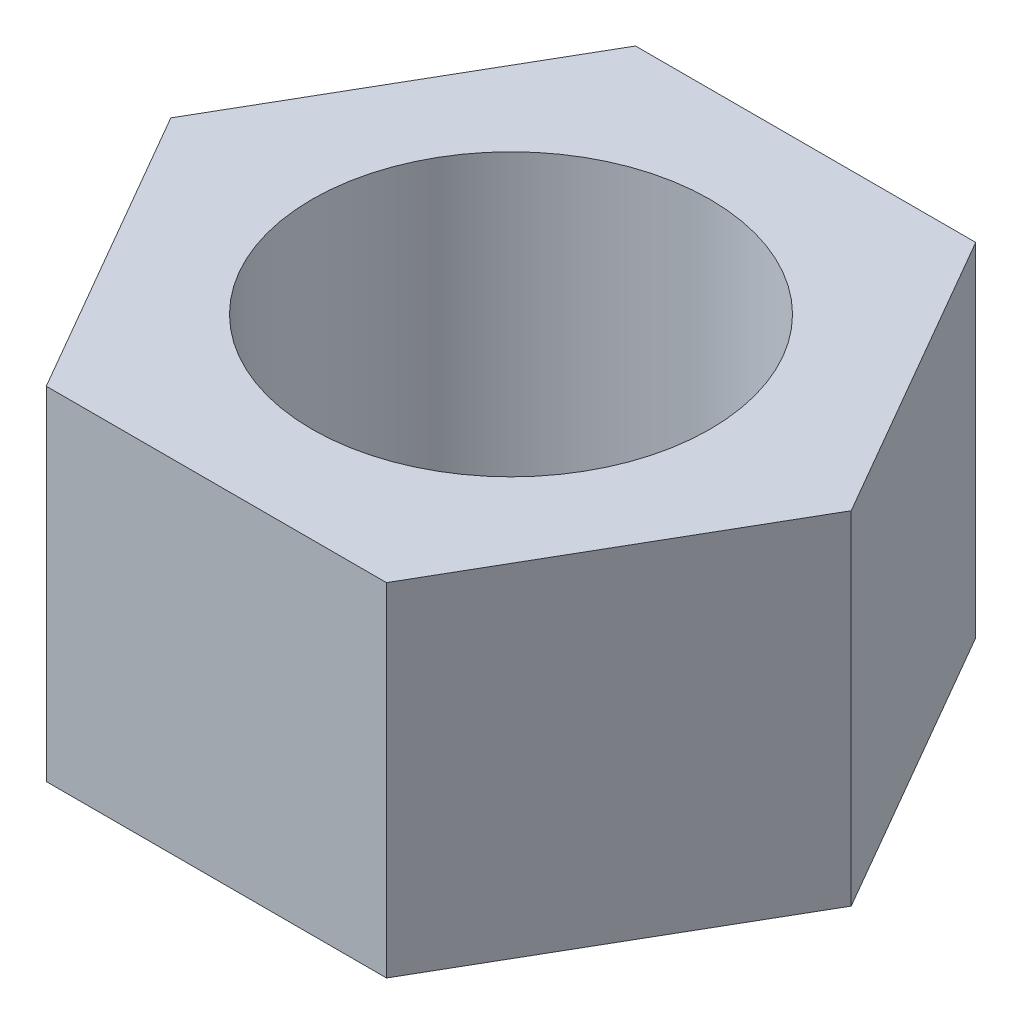
from build123d import *

# Parameters (mm, degrees)
BOSS_EXTRUDE1_DEPTH = 10.922
SKETCH2_R           = 6.35
CUT_EXTRUDE1_DEPTH  = 19.038173226


with BuildPart() as part:
    # Sketch1 → Boss-Extrude1 (new body)
    with BuildSketch(Plane(origin=(0, 0, 0), x_dir=(1, 0, 0), z_dir=(0, 1, 0))):
        Polygon((5.42593783, -9.398), (10.85187566, 0), (5.42593783, 9.398), (-5.42593783, 9.398), (-10.85187566, 0), (-5.42593783, -9.398), align=None)
    extrude(amount=BOSS_EXTRUDE1_DEPTH)

    # Sketch2 → Cut-Extrude1 (cut, through all)
    with BuildSketch(Plane(origin=(0, 10.922, 0), x_dir=(1, 0, 0), z_dir=(0, 1, 0))):
        with Locations(Location((0, 0, 0), (0, 0, 270))):
            Circle(SKETCH2_R)
    extrude(amount=-CUT_EXTRUDE1_DEPTH, mode=Mode.SUBTRACT)


solid = part.part
